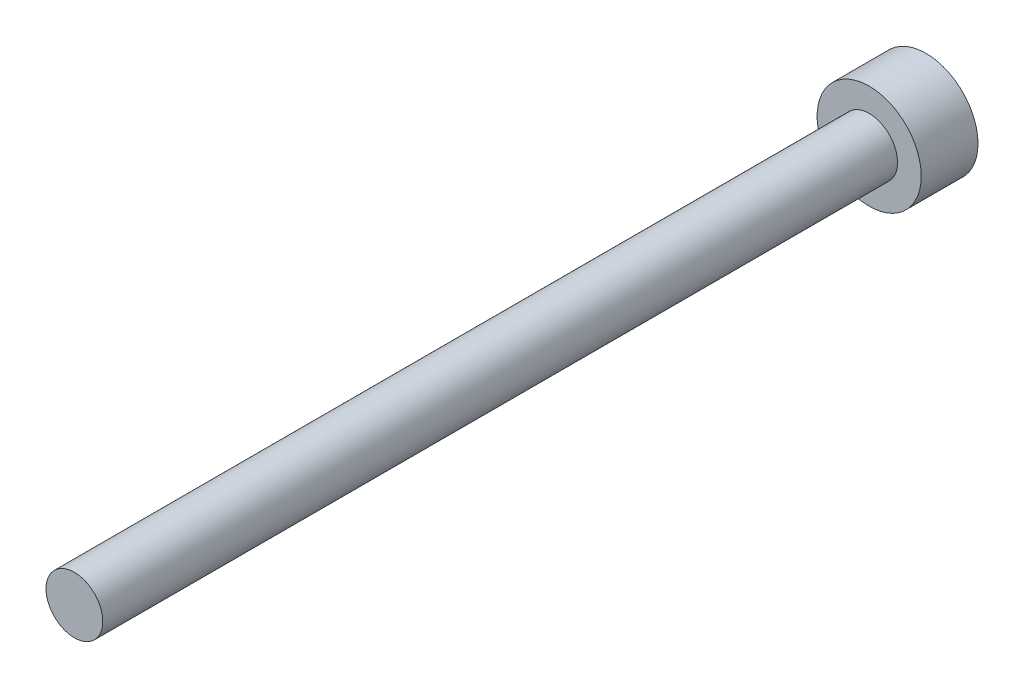
from build123d import *

# Parameters (mm, degrees)
F_01_START                = -3
S01_HEAD_R                = 2.75
F_01_HEAD_DEPTH           = 3
S02_NOMINAL_SHANK_R       = 1.5
F_02_NOMINAL_SHANK_DEPTH  = 42
F_03_START                = -3.1
F_03_HEX_KEY_SOCKET_DEPTH = 1.75


with BuildPart() as part:
    # S01 - Head → 01 - Head (new body)
    with BuildSketch(Plane.XY.offset(F_01_START)):
        Circle(S01_HEAD_R)
    extrude(amount=F_01_HEAD_DEPTH)

    # S02 - Nominal shank → 02 - Nominal shank (add)
    with BuildSketch(Plane.XY):
        with Locations(Location((0, 0, 0), (0, 0, 180))):
            Circle(S02_NOMINAL_SHANK_R)
    extrude(amount=F_02_NOMINAL_SHANK_DEPTH)

    # S03 - Hex key socket → 03 - Hex key socket (cut)
    with BuildSketch(Plane.XY.offset(F_03_START)):
        Polygon((1.443375673, 0), (0.721687836, 1.25), (-0.721687836, 1.25), (-1.443375673, 0), (-0.721687836, -1.25), (0.721687836, -1.25), align=None)
    extrude(amount=F_03_HEX_KEY_SOCKET_DEPTH, mode=Mode.SUBTRACT)


solid = part.part
